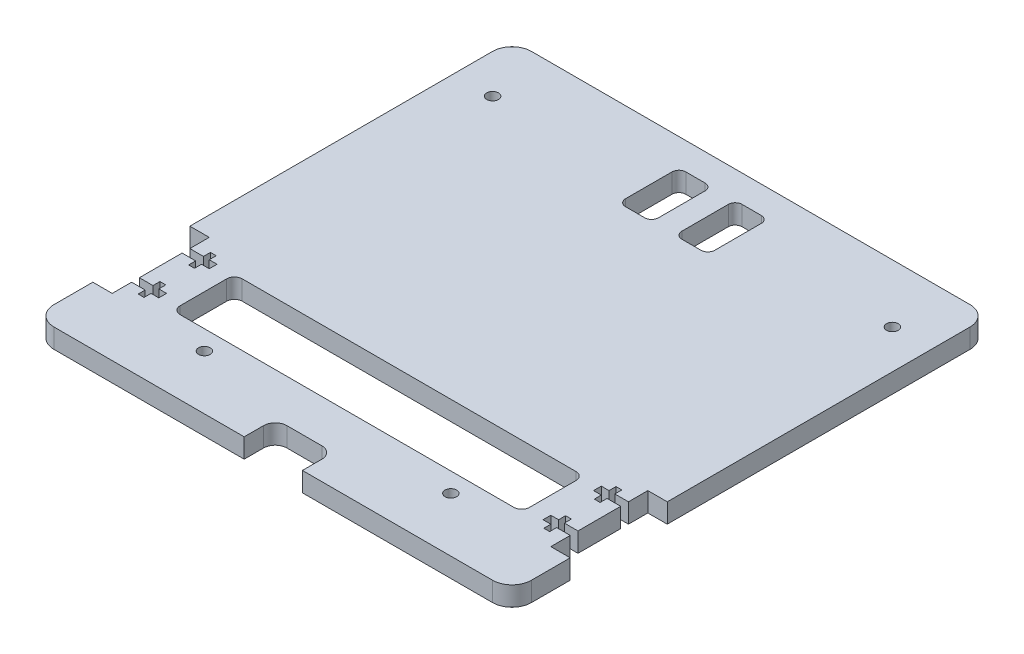
from build123d import *

# Parameters (mm, degrees)
RESSALTO_EXTRUS_O1_DEPTH = 5
CORTE_EXTRUS_O1_DEPTH    = 5
ESBO_O3_W                = 5
ESBO_O3_H                = 25
CORTE_EXTRUS_O3_DEPTH    = 5
CORTE_EXTRUS_O4_DEPTH    = 10
CORTE_EXTRUS_O5_DEPTH    = 5
ESBO_O6_R                = 1.5
CORTE_EXTRUS_O6_DEPTH    = 20
CORTE_EXTRUS_O7_DEPTH    = 10


with BuildPart() as part:
    # Esboço1 → Ressalto-extrusão1 (new body)
    with BuildSketch(Plane(origin=(0, 0, 0), x_dir=(1, 0, 0), z_dir=(0, 1, 0))):
        with BuildLine():
            Line((-56.5, -61.5), (56.5, -61.5))
            ThreePointArc((56.5, -61.5), (60.035533906, -60.035533906), (61.5, -56.5))
            Line((61.5, -56.5), (61.5, 56.5))
            ThreePointArc((61.5, 56.5), (60.035533906, 60.035533906), (56.5, 61.5))
            Line((56.5, 61.5), (-56.5, 61.5))
            ThreePointArc((-56.5, 61.5), (-60.035533906, 60.035533906), (-61.5, 56.5))
            Line((-61.5, 56.5), (-61.5, -56.5))
            ThreePointArc((-61.5, -56.5), (-60.035533906, -60.035533906), (-56.5, -61.5))
        make_face()
    extrude(amount=RESSALTO_EXTRUS_O1_DEPTH)

    # Esboço2 → Corte-extrusão1 (cut)
    with BuildSketch(Plane(origin=(0, 5, 0), x_dir=(1, 0, 0), z_dir=(0, 1, 0))):
        with BuildLine():
            Line((-4.765646957, 54.5), (-9.733117681, 54.5))
            ThreePointArc((-9.733117681, 54.5), (-10.98249215, 53.98249215), (-11.5, 52.733117681))
            Line((-11.5, 52.733117681), (-11.5, 40.733117681))
            ThreePointArc((-11.5, 40.733117681), (-10.98249215, 39.483743212), (-9.733117681, 38.966235362))
            Line((-9.733117681, 38.966235362), (-4.765646957, 38.966235362))
            ThreePointArc((-4.765646957, 38.966235362), (-3.516272487, 39.483743212), (-2.998764638, 40.733117681))
            Line((-2.998764638, 40.733117681), (-2.998764638, 52.733117681))
            ThreePointArc((-2.998764638, 52.733117681), (-3.516272487, 53.98249215), (-4.765646957, 54.5))
        make_face()
        with BuildLine():
            Line((4.768117681, 38.966235362), (9.733117681, 38.966235362))
            ThreePointArc((9.733117681, 38.966235362), (10.98249215, 39.483743212), (11.5, 40.733117681))
            Line((11.5, 40.733117681), (11.5, 52.733117681))
            ThreePointArc((11.5, 52.733117681), (10.98249215, 53.98249215), (9.733117681, 54.5))
            Line((9.733117681, 54.5), (4.768117681, 54.5))
            ThreePointArc((4.768117681, 54.5), (3.518743212, 53.98249215), (3.001235362, 52.733117681))
            Line((3.001235362, 52.733117681), (3.001235362, 40.733117681))
            ThreePointArc((3.001235362, 40.733117681), (3.518743212, 39.483743212), (4.768117681, 38.966235362))
        make_face()
    extrude(amount=-CORTE_EXTRUS_O1_DEPTH, mode=Mode.SUBTRACT)

    # Esboço3 → Corte-extrusão3 (cut)
    with BuildSketch(Plane(origin=(0, 5, 0), x_dir=(1, 0, 0), z_dir=(0, 1, 0))):
        with Locations((-59, -34)):
            Rectangle(ESBO_O3_W, ESBO_O3_H)
        with Locations((59, -34)):
            Rectangle(ESBO_O3_W, ESBO_O3_H)
    extrude(amount=-CORTE_EXTRUS_O3_DEPTH, mode=Mode.SUBTRACT)

    # Esboço4 → Corte-extrusão4 (cut)
    with BuildSketch(Plane(origin=(0, 5, 0), x_dir=(1, 0, 0), z_dir=(0, 1, 0))):
        Polygon((56.5, -41.5), (53, -41.5), (53, -43.3), (51.5, -43.3), (51.5, -41.5), (49.5, -41.5), (49.5, -39.5), (51.5, -39.5), (51.5, -37.7), (53, -37.7), (53, -39.5), (56.5, -39.5), align=None)
        Polygon((56.5, -26.5), (53, -26.5), (53, -24.7), (51.5, -24.7), (51.5, -26.5), (49.5, -26.5), (49.5, -28.5), (51.5, -28.5), (51.5, -30.3), (53, -30.3), (53, -28.5), (56.5, -28.5), align=None)
    corte_extrus_o4 = extrude(amount=-CORTE_EXTRUS_O4_DEPTH, mode=Mode.SUBTRACT)

    # Espelhar1: Corte-extrusão4 across plane
    add(corte_extrus_o4.mirror(Plane(origin=(0, 0, 0), x_dir=(0, 0, 1), z_dir=(1, 0, 0))), mode=Mode.SUBTRACT)

    # Esboço5 → Corte-extrusão5 (cut)
    with BuildSketch(Plane(origin=(0, 5, 0), x_dir=(1, 0, 0), z_dir=(0, 1, 0))):
        with BuildLine():
            Line((43, -42.5), (-43, -42.5))
            ThreePointArc((-43, -42.5), (-44.414213562, -41.914213562), (-45, -40.5))
            Line((-45, -40.5), (-45, -28.5))
            ThreePointArc((-45, -28.5), (-44.414213562, -27.085786438), (-43, -26.5))
            Line((-43, -26.5), (43, -26.5))
            ThreePointArc((43, -26.5), (44.414213562, -27.085786438), (45, -28.5))
            Line((45, -28.5), (45, -40.5))
            ThreePointArc((45, -40.5), (44.414213562, -41.914213562), (43, -42.5))
        make_face()
    extrude(amount=-CORTE_EXTRUS_O5_DEPTH, mode=Mode.SUBTRACT)

    # Esboço6 → Corte-extrusão6 (cut)
    with BuildSketch(Plane(origin=(0, 5, 0), x_dir=(1, 0, 0), z_dir=(0, 1, 0))):
        with Locations(Location((-51.5, 46.5, 0), (0, 0, 270))):
            Circle(ESBO_O6_R)
        with Locations(Location((51.5, 46.5, 0), (0, 0, 270))):
            Circle(ESBO_O6_R)
        with Locations(Location((31.75, -47.5, 0), (0, 0, 270))):
            Circle(ESBO_O6_R)
        with Locations(Location((-31.75, -47.5, 0), (0, 0, 270))):
            Circle(ESBO_O6_R)
    extrude(amount=-CORTE_EXTRUS_O6_DEPTH, mode=Mode.SUBTRACT)

    # Esboço7 → Corte-extrusão7 (cut)
    with BuildSketch(Plane.XZ):
        with BuildLine():
            Line((7.5, 61.5), (-7.5, 61.5))
            Line((-7.5, 61.5), (-7.5, 56.5))
            ThreePointArc((-7.5, 56.5), (-6.621320344, 54.378679656), (-4.5, 53.5))
            Line((-4.5, 53.5), (4.5, 53.5))
            ThreePointArc((4.5, 53.5), (6.621320344, 54.378679656), (7.5, 56.5))
            Line((7.5, 56.5), (7.5, 61.5))
        make_face()
    extrude(amount=-CORTE_EXTRUS_O7_DEPTH, mode=Mode.SUBTRACT)


solid = part.part
